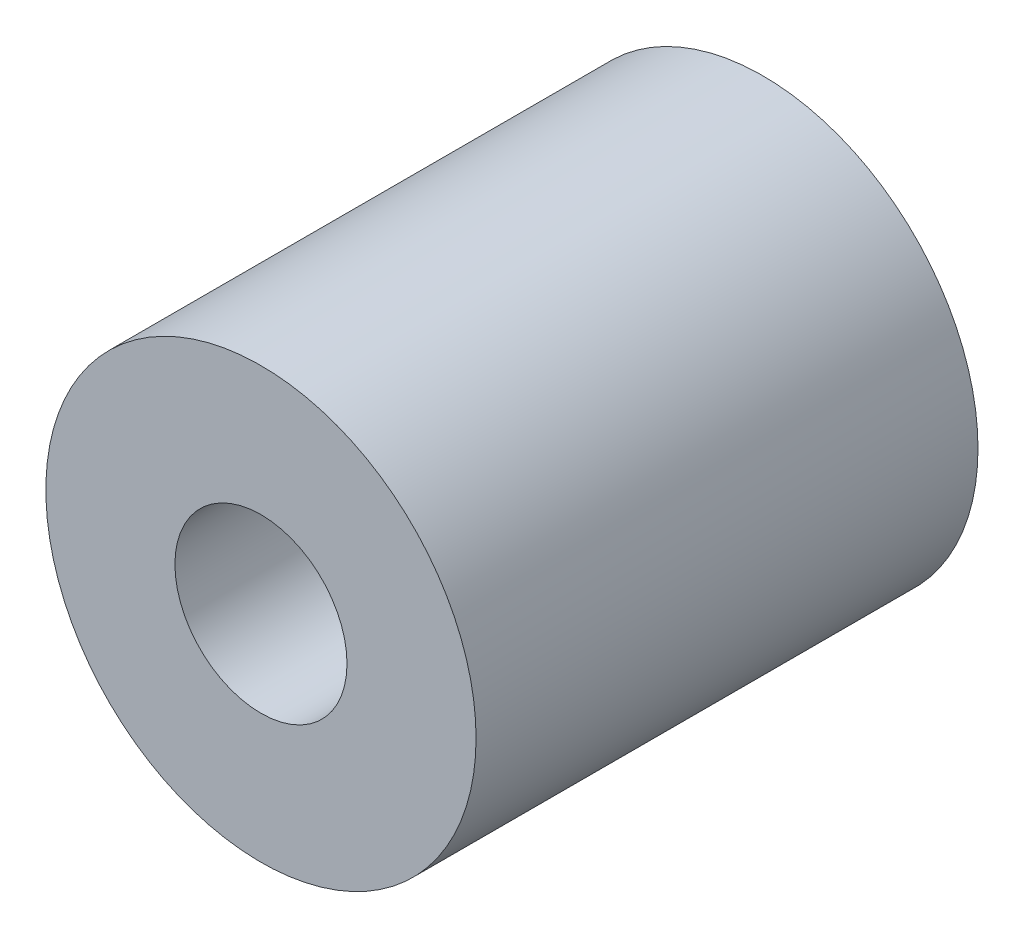
from build123d import *

# Parameters (mm, degrees)
SKETCH_1_R          = 15
EXTRUDE_1_DEPTH     = 35
SKETCH_2_R          = 6
CUT_EXTRUDE_1_DEPTH = 11.5
SKETCH_3_R          = 5
CUT_EXTRUDE_2_DEPTH = 11.5


with BuildPart() as part:
    # 草图1 → 凸台-拉伸1 (new body)
    with BuildSketch(Plane.XY):
        Circle(SKETCH_1_R)
    extrude(amount=EXTRUDE_1_DEPTH)

    # 草图2 → 切除-拉伸1 (cut)
    with BuildSketch(Plane.XY.offset(35)):
        Circle(SKETCH_2_R)
    extrude(amount=-CUT_EXTRUDE_1_DEPTH, mode=Mode.SUBTRACT)

    # 草图3 → 切除-拉伸2 (cut)
    with BuildSketch(Plane(origin=(0, 0, 0), x_dir=(-1, 0, 0), z_dir=(0, 0, -1))):
        Circle(SKETCH_3_R)
    extrude(amount=-CUT_EXTRUDE_2_DEPTH, mode=Mode.SUBTRACT)


solid = part.part
